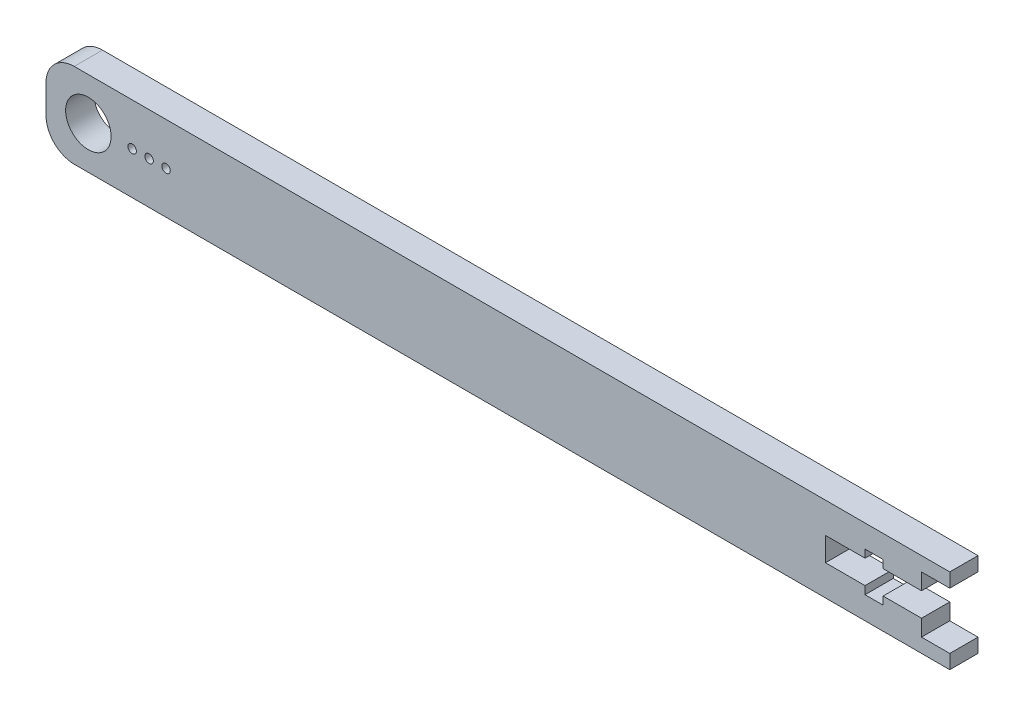
from build123d import *

# Parameters (mm, degrees)
SKETCH1_R           = 4.025
SKETCH1_R_2         = 0.75
SKETCH1_W           = 5
SKETCH1_H           = 10
BOSS_EXTRUDE1_DEPTH = 5
CUT_EXTRUDE1_DEPTH  = 10
CUT_EXTRUDE2_DEPTH  = 10


with BuildPart() as part:
    # Sketch1 → Boss-Extrude1 (new body)
    with BuildSketch(Plane.XY):
        with BuildLine():
            Line((-215, 15), (-60, 15))
            ThreePointArc((-60, 15), (-56.464466094, 13.535533906), (-55, 10))
            Line((-55, 10), (-55, 5))
            ThreePointArc((-55, 5), (-56.464466094, 1.464466094), (-60, 0))
            Line((-60, 0), (-215, 0))
            ThreePointArc((-215, 0), (-218.535533906, 1.464466094), (-220, 5))
            Line((-220, 5), (-220, 10))
            ThreePointArc((-220, 10), (-218.535533906, 13.535533906), (-215, 15))
        make_face()
        with Locations((-212.5, 7.5)):
            Circle(SKETCH1_R, mode=Mode.SUBTRACT)
        with Locations((-204.75, 7.5)):
            Circle(SKETCH1_R_2, mode=Mode.SUBTRACT)
        with Locations((-201.75, 7.5)):
            Circle(SKETCH1_R_2, mode=Mode.SUBTRACT)
        with Locations((-198.75, 7.5)):
            Circle(SKETCH1_R_2, mode=Mode.SUBTRACT)
        with Locations((-62.5, 7.5)):
            Rectangle(SKETCH1_W, SKETCH1_H, mode=Mode.SUBTRACT)
    extrude(amount=BOSS_EXTRUDE1_DEPTH)

    # Sketch2 → Cut-Extrude1 (cut)
    with BuildSketch(Plane(origin=(0, 0, 0), x_dir=(-1, 0, 0), z_dir=(0, 0, -1))):
        Polygon((65, 9.6), (71.8, 9.6), (71.8, 11), (75, 11), (75, 9.6), (82, 9.6), (82, 5.4), (75, 5.4), (75, 4), (71.8, 4), (71.8, 5.4), (65, 5.4), align=None)
    extrude(amount=-CUT_EXTRUDE1_DEPTH, mode=Mode.SUBTRACT)

    # Sketch3 → Cut-Extrude2 (cut)
    with BuildSketch(Plane(origin=(0, 0, 0), x_dir=(-1, 0, 0), z_dir=(0, 0, -1))):
        with BuildLine():
            Line((60, 15), (60, 0))
            ThreePointArc((60, 0), (56.464466094, 1.464466094), (55, 5))
            Line((55, 5), (55, 10))
            ThreePointArc((55, 10), (56.464466094, 13.535533906), (60, 15))
        make_face()
    extrude(amount=-CUT_EXTRUDE2_DEPTH, mode=Mode.SUBTRACT)


solid = part.part
